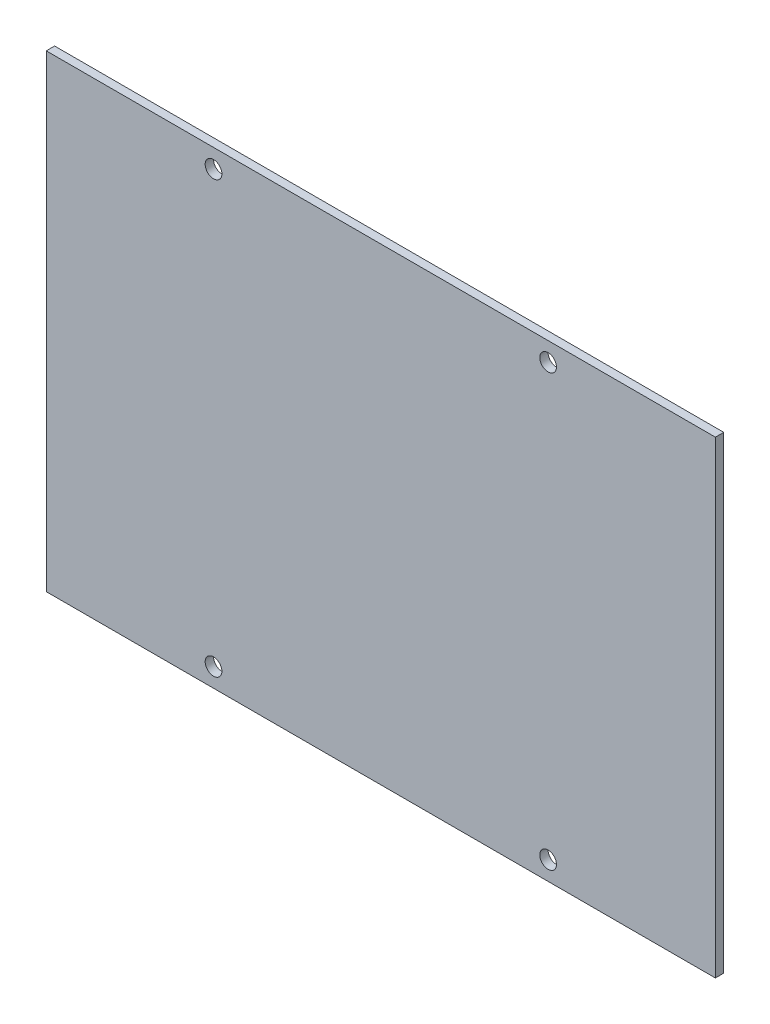
from build123d import *

# Parameters (mm, degrees)
SKETCH1_W           = 160
SKETCH1_H           = 112
BOSS_EXTRUDE1_DEPTH = 2
SKETCH2_R           = 2
CUT_EXTRUDE1_DEPTH  = 196.315129982


with BuildPart() as part:
    # Sketch1 → Boss-Extrude1 (new body)
    with BuildSketch(Plane.XY):
        with Locations((80, 56)):
            Rectangle(SKETCH1_W, SKETCH1_H)
    extrude(amount=BOSS_EXTRUDE1_DEPTH)

    # Sketch2 → Cut-Extrude1 (cut, through all)
    with BuildSketch(Plane.XY.offset(2)):
        with Locations((40, 107.5)):
            Circle(SKETCH2_R)
        with Locations((120, 107.5)):
            Circle(SKETCH2_R)
        with Locations((40, 4.5)):
            Circle(SKETCH2_R)
        with Locations((120, 4.5)):
            Circle(SKETCH2_R)
    extrude(amount=-CUT_EXTRUDE1_DEPTH, mode=Mode.SUBTRACT)


solid = part.part
